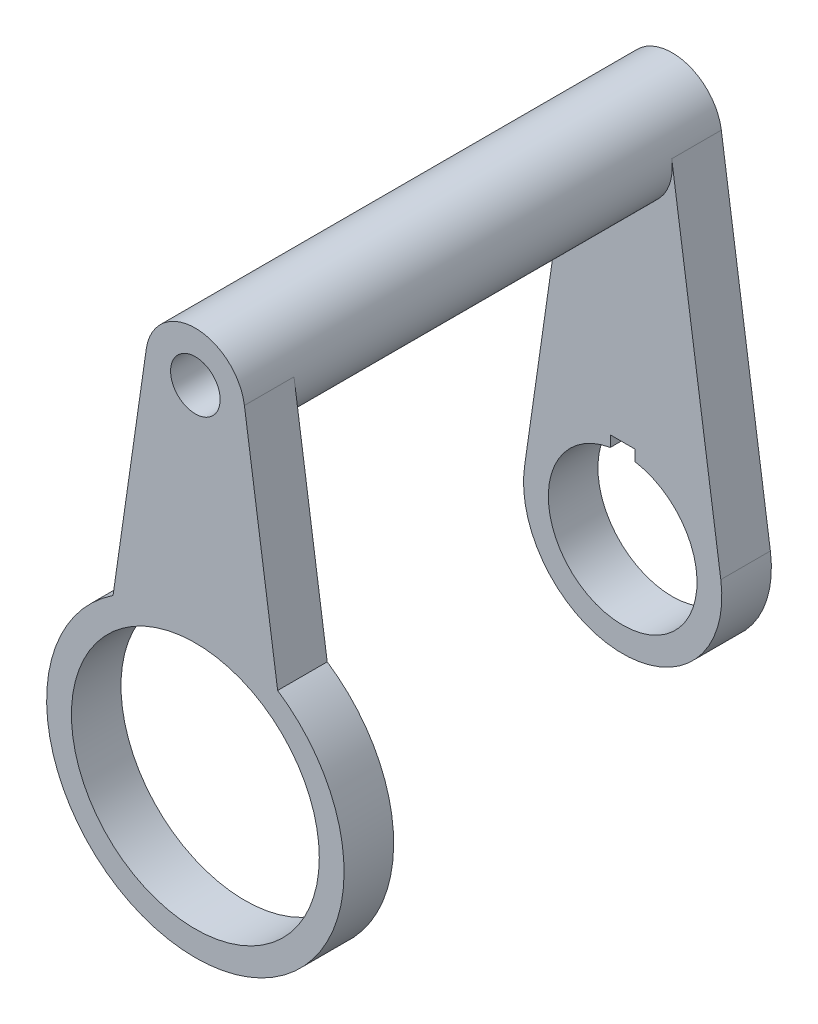
from build123d import *

# Parameters (mm, degrees)
SKETCH2_R           = 5
BOSS_EXTRUDE1_DEPTH = 10
SKETCH3_R           = 10
SKETCH3_R_2         = 5
BOSS_EXTRUDE2_DEPTH = 76.2
BOSS_EXTRUDE3_START = 86.2
SKETCH2_2_R         = 5
BOSS_EXTRUDE3_DEPTH = 10
SKETCH5_R           = 30
BOSS_EXTRUDE4_DEPTH = 10
SKETCH6_R           = 25
CUT_EXTRUDE1_DEPTH  = 10


with BuildPart() as part:
    # Sketch2 → Boss-Extrude1 (new body)
    with BuildSketch(Plane.XY):
        with BuildLine():
            Line((-19.794866372, 2.857142857), (-9.897433186, 71.428571429))
            ThreePointArc((-9.897433186, 71.428571429), (0, 80), (9.897433186, 71.428571429))
            Line((9.897433186, 71.428571429), (19.794866372, 2.857142857))
            ThreePointArc((19.794866372, 2.857142857), (0, -20), (-19.794866372, 2.857142857))
        make_face()
        with Locations((0, 70)):
            Circle(SKETCH2_R, mode=Mode.SUBTRACT)
        with BuildLine():
            Line((-2.5, 14.790199458), (-2.5, 17))
            Line((-2.5, 17), (2.5, 17))
            Line((2.5, 17), (2.5, 14.790199458))
            ThreePointArc((2.5, 14.790199458), (0, -15), (-2.5, 14.790199458))
        make_face(mode=Mode.SUBTRACT)
    extrude(amount=BOSS_EXTRUDE1_DEPTH)

    # Sketch3 → Boss-Extrude2 (add)
    with BuildSketch(Plane.XY.offset(10)):
        with Locations(Location((0, 70, 0), (0, 0, 171.786789298))):
            Circle(SKETCH3_R)
        with Locations((0, 70)):
            Circle(SKETCH3_R_2, mode=Mode.SUBTRACT)
    extrude(amount=BOSS_EXTRUDE2_DEPTH)

    # Sketch2<2> → Boss-Extrude3 (add)
    with BuildSketch(Plane.XY.offset(BOSS_EXTRUDE3_START)):
        with BuildLine():
            Line((-19.794866372, 2.857142857), (-9.897433186, 71.428571429))
            ThreePointArc((-9.897433186, 71.428571429), (0, 80), (9.897433186, 71.428571429))
            Line((9.897433186, 71.428571429), (19.794866372, 2.857142857))
            ThreePointArc((19.794866372, 2.857142857), (0, -20), (-19.794866372, 2.857142857))
        make_face()
        with Locations((0, 70)):
            Circle(SKETCH2_2_R, mode=Mode.SUBTRACT)
        with BuildLine():
            Line((-2.5, 14.790199458), (-2.5, 17))
            Line((-2.5, 17), (2.5, 17))
            Line((2.5, 17), (2.5, 14.790199458))
            ThreePointArc((2.5, 14.790199458), (0, -15), (-2.5, 14.790199458))
        make_face(mode=Mode.SUBTRACT)
    extrude(amount=BOSS_EXTRUDE3_DEPTH)

    # Sketch5 → Boss-Extrude4 (add)
    with BuildSketch(Plane.XY.offset(96.2)):
        Circle(SKETCH5_R)
    extrude(amount=-BOSS_EXTRUDE4_DEPTH)

    # Sketch6 → Cut-Extrude1 (cut)
    with BuildSketch(Plane.XY.offset(96.2)):
        Circle(SKETCH6_R)
    extrude(amount=-CUT_EXTRUDE1_DEPTH, mode=Mode.SUBTRACT)


solid = part.part
